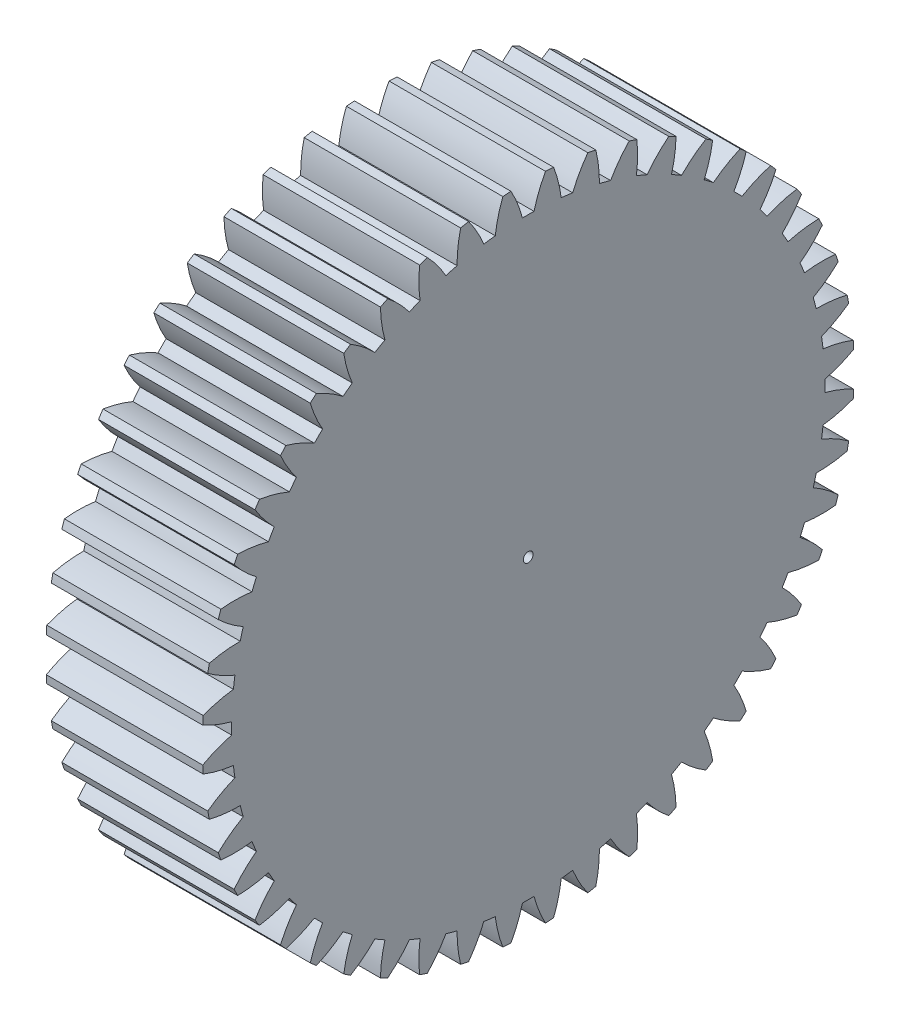
from build123d import *

# Parameters (mm, degrees)
BASPROSKE_W     = 12.7
BASPROSKE_H     = 26.458333333
TOOTHCUT_DEPTH  = 40.514260787
TEETHCUTS_COUNT = 48
TEETHCUTS_ANGLE = 352.5
BORSKE_R        = 0.396875
BORE_DEPTH      = 50.8000508


with BuildPart() as part:
    # BasProSke → Base-Revolve (revolve)
    with BuildSketch(Plane(origin=(0, 0, 0), x_dir=(1, 0, 0), z_dir=(0, 1, 0)), mode=Mode.PRIVATE) as base_revolve_sk:
        with Locations((6.35, 13.229166667)):
            Rectangle(BASPROSKE_W, BASPROSKE_H)
    revolve(base_revolve_sk.sketch.rotate(Axis((-10, 0, 0), (1, 0, 0)), 180), axis=Axis((-10, 0, 0), (1, 0, 0)))

    # TooCutSke → ToothCut (cut, through all)
    with BuildSketch(Plane(origin=(0, 0, 0), x_dir=(0, 0, -1), z_dir=(1, 0, 0))):
        with BuildLine():
            ThreePointArc((0.470049195, 24.074611656), (0, 24.0792), (-0.470049195, 24.074611656))
            ThreePointArc((-0.470049195, 24.074611656), (-0.867811068, 25.290054078), (-1.415110271, 26.445899383))
            ThreePointArc((-1.415110271, 26.445899383), (0, 26.483733333), (1.415110271, 26.445899383))
            ThreePointArc((1.415110271, 26.445899383), (0.867811068, 25.290054078), (0.470049195, 24.074611656))
        make_face()
    toothcut = extrude(amount=TOOTHCUT_DEPTH, mode=Mode.SUBTRACT)

    # TeethCuts: ToothCut ×48 about axis
    teethcuts_axis = Axis((-10, 0, 0), (1, 0, 0))
    for i in range(1, TEETHCUTS_COUNT):
        add(toothcut.rotate(teethcuts_axis, i * TEETHCUTS_ANGLE / (TEETHCUTS_COUNT - 1)), mode=Mode.SUBTRACT)

    # BorSke → Bore (cut, symmetric)
    with BuildSketch(Plane(origin=(0, 0, 0), x_dir=(0, 0, -1), z_dir=(1, 0, 0))):
        with Locations(Location((0, 0, 0), (0, 0, 180))):
            Circle(BORSKE_R)
    extrude(amount=BORE_DEPTH, both=True, mode=Mode.SUBTRACT)


solid = part.part
